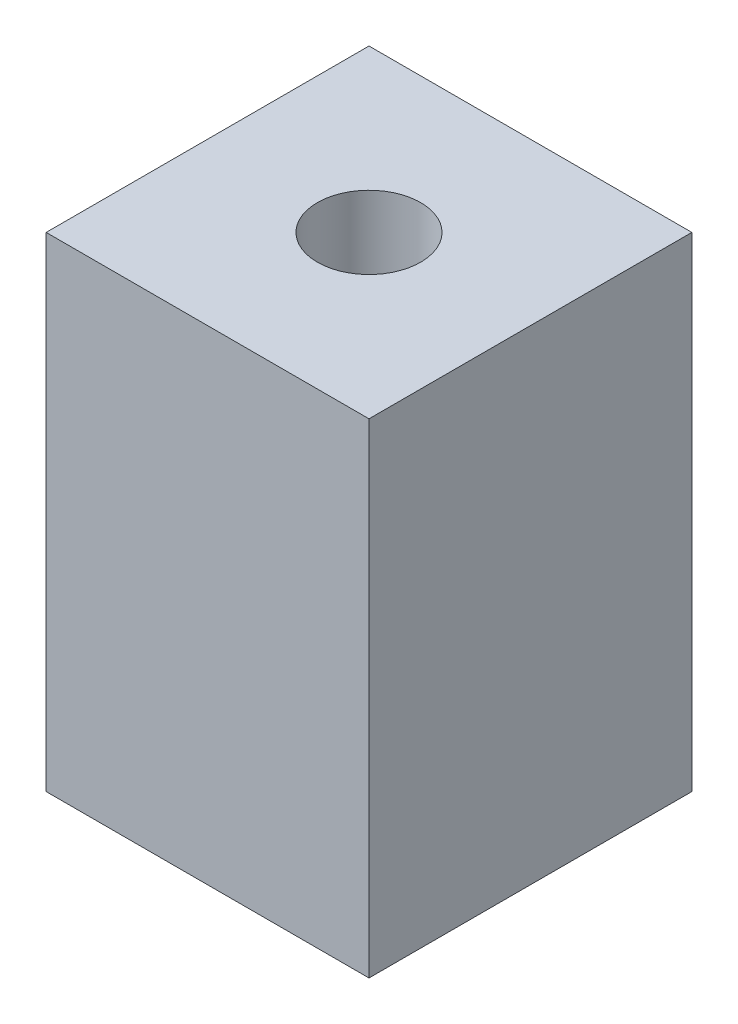
from build123d import *

# Parameters (mm, degrees)
SKETCH1_W           = 20
SKETCH1_H           = 20
BOSS_EXTRUDE1_DEPTH = 30
SKETCH2_R           = 3.2
CUT_EXTRUDE1_DEPTH  = 38.416573868


with BuildPart() as part:
    # Sketch1 → Boss-Extrude1 (new body)
    with BuildSketch(Plane(origin=(0, 0, 0), x_dir=(1, 0, 0), z_dir=(0, 1, 0))):
        with Locations((-10, 0)):
            Rectangle(SKETCH1_W, SKETCH1_H)
    extrude(amount=BOSS_EXTRUDE1_DEPTH)

    # Sketch2 → Cut-Extrude1 (cut, through all)
    with BuildSketch(Plane(origin=(0, 30, 0), x_dir=(1, 0, 0), z_dir=(0, 1, 0))):
        with Locations(Location((-10, 0, 0), (0, 0, 270))):
            Circle(SKETCH2_R)
    extrude(amount=-CUT_EXTRUDE1_DEPTH, mode=Mode.SUBTRACT)


solid = part.part
